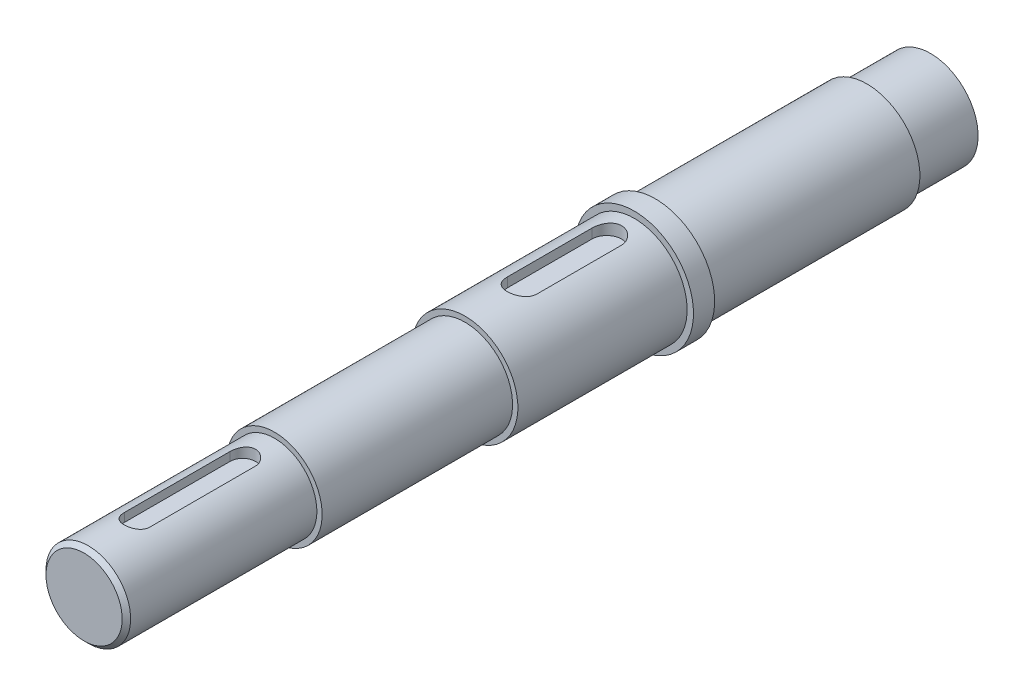
from build123d import *

# Parameters (mm, degrees)
CUT_EXTRUDE1_DEPTH  = 5
CUT_EXTRUDE12_DEPTH = 5.5
CHAMFER1_SIZE       = 2


with BuildPart() as part:
    # Sketch1 → Revolve1 (revolve)
    with BuildSketch(Plane(origin=(0, 0, 0), x_dir=(1, 0, 0), z_dir=(0, 1, 0)), mode=Mode.PRIVATE) as revolve1_sk:
        Polygon((0, 0), (0, -400), (20, -400), (20, -310), (22.5, -310), (22.5, -220), (25, -220), (25, -140), (28, -140), (28, -130), (25, -130), (25, -30), (22.5, -30), (22.5, 0), align=None)
    revolve(revolve1_sk.sketch.rotate(Axis((0, 0, 0), (0, 0, 1)), 180), axis=Axis((0, 0, 0), (0, 0, 1)))

    # Sketch3 → Cut-Extrude1 (cut)
    with BuildSketch(Plane(origin=(0, 20, 400), x_dir=(0, 0, 1), z_dir=(0, -1, 0))):
        with BuildLine():
            Line((-25, 6), (-75, 6))
            ThreePointArc((-75, 6), (-81, 0), (-75, -6))
            Line((-75, -6), (-25, -6))
            ThreePointArc((-25, -6), (-19, 0), (-25, 6))
        make_face()
    extrude(amount=CUT_EXTRUDE1_DEPTH, mode=Mode.SUBTRACT)

    # Sketch32 → Cut-Extrude12 (cut)
    with BuildSketch(Plane(origin=(0, 25, 220), x_dir=(0, 0, 1), z_dir=(0, -1, 0))):
        with BuildLine():
            Line((-27, 7), (-67, 7))
            ThreePointArc((-67, 7), (-74, 0), (-67, -7))
            Line((-67, -7), (-27, -7))
            ThreePointArc((-27, -7), (-20, 0), (-27, 7))
        make_face()
    extrude(amount=CUT_EXTRUDE12_DEPTH, mode=Mode.SUBTRACT)

    # Chamfer1
    chamfer1_edges = [part.edges().sort_by_distance(p)[0] for p in [
        (20, 0, 400),
    ]]
    chamfer(chamfer1_edges, length=CHAMFER1_SIZE)


solid = part.part
